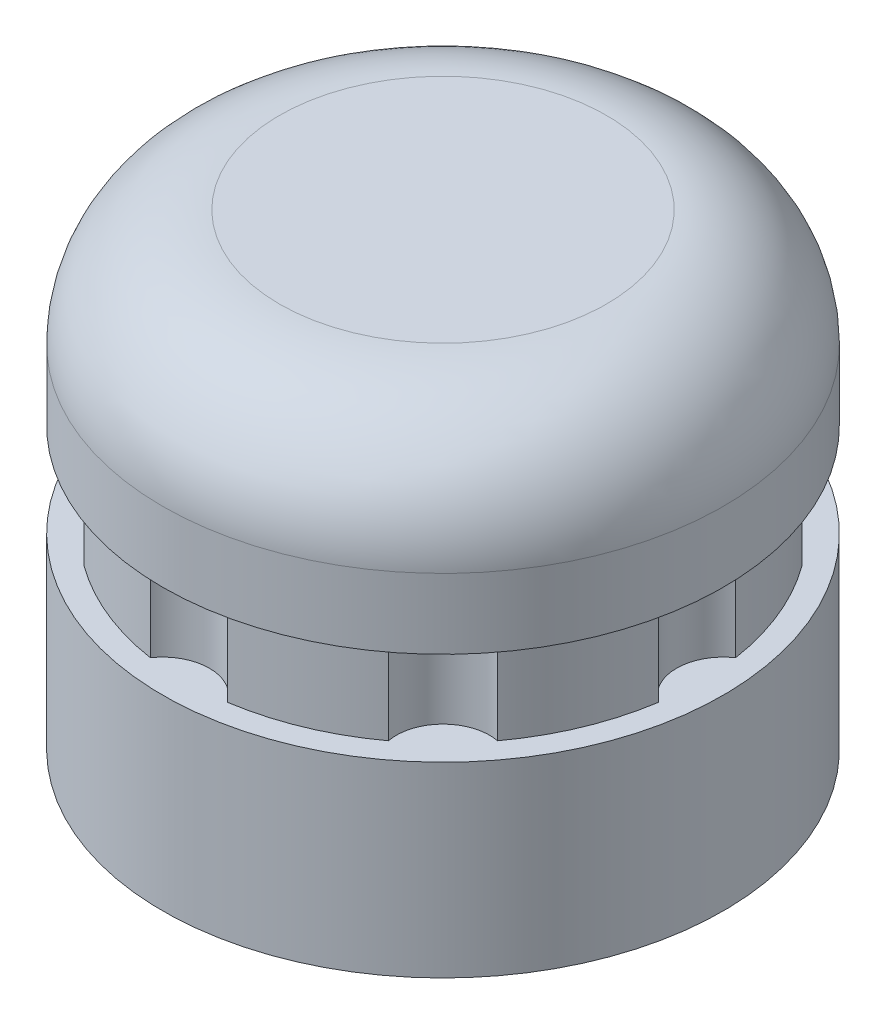
from build123d import *

# Parameters (mm, degrees)
SALIENTE_EXTRUIR3_DEPTH = 20
CROQUIS13_R             = 12
SALIENTE_EXTRUIR4_DEPTH = 8
SALIENTE_EXTRUIR5_START = -8
CROQUIS15_R             = 12
SALIENTE_EXTRUIR5_DEPTH = 8
CROQUIS16_R             = 5
CORTAR_EXTRUIR6_DEPTH   = 2
CROQUIS17_R             = 2.5
CORTAR_EXTRUIR7_DEPTH   = 2
CORTAR_EXTRUIR8_DEPTH   = 7
REDONDEO2_R             = 5


with BuildPart() as part:
    # Croquis12 → Saliente-Extruir3 (new body)
    with BuildSketch(Plane(origin=(0, 0, 0), x_dir=(1, 0, 0), z_dir=(0, 1, 0))):
        with BuildLine():
            ThreePointArc((10.875, -1.653594569), (10, 0), (10.875, 1.653594569))
            ThreePointArc((10.875, 1.653594569), (10.162674858, 4.209517756), (8.859054179, 6.520518312))
            ThreePointArc((8.859054179, 6.520518312), (7.071067812, 7.071067812), (6.520518312, 8.859054179))
            ThreePointArc((6.520518312, 8.859054179), (4.209517756, 10.162674858), (1.653594569, 10.875))
            ThreePointArc((1.653594569, 10.875), (0, 10), (-1.653594569, 10.875))
            ThreePointArc((-1.653594569, 10.875), (-4.209517756, 10.162674858), (-6.520518312, 8.859054179))
            ThreePointArc((-6.520518312, 8.859054179), (-6.494110095, 8.672996418), (-6.485281374, 8.485281374))
            ThreePointArc((-6.485281374, 8.485281374), (-7.210045241, 6.94457608), (-8.859054179, 6.520518312))
            ThreePointArc((-8.859054179, 6.520518312), (-10.162674858, 4.209517756), (-10.875, 1.653594569))
            ThreePointArc((-10.875, 1.653594569), (-10.232233047, 0.935414347), (-10, 0))
            ThreePointArc((-10, 0), (-10.232233047, -0.935414347), (-10.875, -1.653594569))
            ThreePointArc((-10.875, -1.653594569), (-10.162674858, -4.209517756), (-8.859054179, -6.520518312))
            ThreePointArc((-8.859054179, -6.520518312), (-7.210045241, -6.94457608), (-6.485281374, -8.485281374))
            ThreePointArc((-6.485281374, -8.485281374), (-6.494110095, -8.672996418), (-6.520518312, -8.859054179))
            ThreePointArc((-6.520518312, -8.859054179), (-4.209517756, -10.162674858), (-1.653594569, -10.875))
            ThreePointArc((-1.653594569, -10.875), (0, -10), (1.653594569, -10.875))
            ThreePointArc((1.653594569, -10.875), (4.209517756, -10.162674858), (6.520518312, -8.859054179))
            ThreePointArc((6.520518312, -8.859054179), (7.071067812, -7.071067812), (8.859054179, -6.520518312))
            ThreePointArc((8.859054179, -6.520518312), (10.162674858, -4.209517756), (10.875, -1.653594569))
        make_face()
    extrude(amount=SALIENTE_EXTRUIR3_DEPTH)

    # Croquis13 → Saliente-Extruir4 (add)
    with BuildSketch(Plane.XZ):
        with Locations(Location((0, 0, 0), (0, 0, 270))):
            Circle(CROQUIS13_R)
    extrude(amount=-SALIENTE_EXTRUIR4_DEPTH)

    # Croquis15 → Saliente-Extruir5 (add)
    with BuildSketch(Plane(origin=(0, 20, 0), x_dir=(1, 0, 0), z_dir=(0, 1, 0)).offset(SALIENTE_EXTRUIR5_START)):
        with Locations(Location((0, 0, 0), (0, 0, 90))):
            Circle(CROQUIS15_R)
    extrude(amount=SALIENTE_EXTRUIR5_DEPTH)

    # Croquis16 → Cortar-Extruir6 (cut)
    with BuildSketch(Plane.XZ):
        with Locations(Location((0, 0, 0), (0, 0, 270))):
            Circle(CROQUIS16_R)
    extrude(amount=-CORTAR_EXTRUIR6_DEPTH, mode=Mode.SUBTRACT)

    # Croquis17 → Cortar-Extruir7 (cut)
    with BuildSketch(Plane.XZ.offset(-2)):
        with Locations(Location((0, 0, 0), (0, 0, 270))):
            Circle(CROQUIS17_R)
    extrude(amount=-CORTAR_EXTRUIR7_DEPTH, mode=Mode.SUBTRACT)

    # Croquis18 → Cortar-Extruir8 (cut)
    with BuildSketch(Plane.XZ.offset(-4)):
        with BuildLine():
            Line((-1.5, 2), (-1.5, -2))
            ThreePointArc((-1.5, -2), (0, -2.5), (1.5, -2))
            Line((1.5, -2), (1.5, 2))
            ThreePointArc((1.5, 2), (0, 2.5), (-1.5, 2))
        make_face()
    extrude(amount=-CORTAR_EXTRUIR8_DEPTH, mode=Mode.SUBTRACT)

    # Redondeo2
    redondeo2_edges = [part.edges().sort_by_distance(p)[0] for p in [
        (0, 20, 12),
    ]]
    fillet(redondeo2_edges, radius=REDONDEO2_R)


solid = part.part
